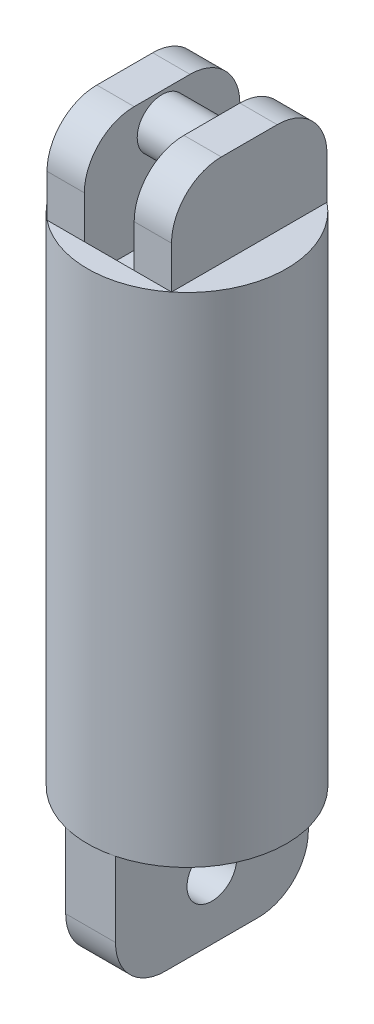
from build123d import *

# Parameters (mm, degrees)
SKETCH1_R           = 50.8
BOSS_EXTRUDE1_DEPTH = 254
SKETCH2_W           = 63.5
SKETCH2_H           = 79.31147458
BOSS_EXTRUDE2_DEPTH = 46.99
SKETCH3_W           = 25.4
SKETCH3_H           = 79.31147458
CUT_EXTRUDE1_DEPTH  = 63.5
FILLET1_R           = 25.4
SKETCH7_W           = 25.4
SKETCH7_H           = 98.373776994
BOSS_EXTRUDE3_DEPTH = 63.5
SKETCH8_R           = 12.7
CUT_EXTRUDE5_DEPTH  = 312.781766786
FILLET2_R           = 25.4
SKETCH6_R           = 12.7
BOSS_EXTRUDE4_DEPTH = 53.34


with BuildPart() as part:
    # Sketch1 → Boss-Extrude1 (new body)
    with BuildSketch(Plane(origin=(0, 0, 0), x_dir=(1, 0, 0), z_dir=(0, 1, 0))):
        with Locations(Location((0, 0, 0), (0, 0, 270))):
            Circle(SKETCH1_R)
    extrude(amount=BOSS_EXTRUDE1_DEPTH)

    # Sketch2 → Boss-Extrude2 (add)
    with BuildSketch(Plane(origin=(0, 254, 0), x_dir=(1, 0, 0), z_dir=(0, 1, 0))):
        Rectangle(SKETCH2_W, SKETCH2_H)
    extrude(amount=BOSS_EXTRUDE2_DEPTH)

    # Sketch3 → Cut-Extrude1 (cut)
    with BuildSketch(Plane(origin=(0, 300.99, 0), x_dir=(1, 0, 0), z_dir=(0, 1, 0))):
        Rectangle(SKETCH3_W, SKETCH3_H)
    extrude(amount=-CUT_EXTRUDE1_DEPTH, mode=Mode.SUBTRACT)

    # Fillet1
    fillet1_edges = [part.edges().sort_by_distance(p)[0] for p in [
        (22.225, 300.99, -39.65573729),
        (-22.225, 300.99, 39.65573729),
        (-22.225, 300.99, -39.65573729),
        (22.225, 300.99, 39.65573729),
    ]]
    fillet(fillet1_edges, radius=FILLET1_R)

    # Sketch7 → Boss-Extrude3 (add)
    with BuildSketch(Plane.XZ):
        Rectangle(SKETCH7_W, SKETCH7_H)
    extrude(amount=BOSS_EXTRUDE3_DEPTH)

    # Sketch8 → Cut-Extrude5 (cut, through all)
    with BuildSketch(Plane(origin=(12.7, 0, 0), x_dir=(0, 0, -1), z_dir=(1, 0, 0))):
        with Locations((0, -31.75)):
            Circle(SKETCH8_R)
    extrude(amount=-CUT_EXTRUDE5_DEPTH, mode=Mode.SUBTRACT)

    # Fillet2
    fillet2_edges = [part.edges().sort_by_distance(p)[0] for p in [
        (0, -63.5, 49.186888497),
        (0, -63.5, -49.186888497),
    ]]
    fillet(fillet2_edges, radius=FILLET2_R)

    # Sketch6 → Boss-Extrude4 (add)
    with BuildSketch(Plane(origin=(31.75, 0, 0), x_dir=(0, 0, -1), z_dir=(1, 0, 0))):
        with Locations((0, 286.494432144)):
            Circle(SKETCH6_R)
    extrude(amount=-BOSS_EXTRUDE4_DEPTH)


solid = part.part
